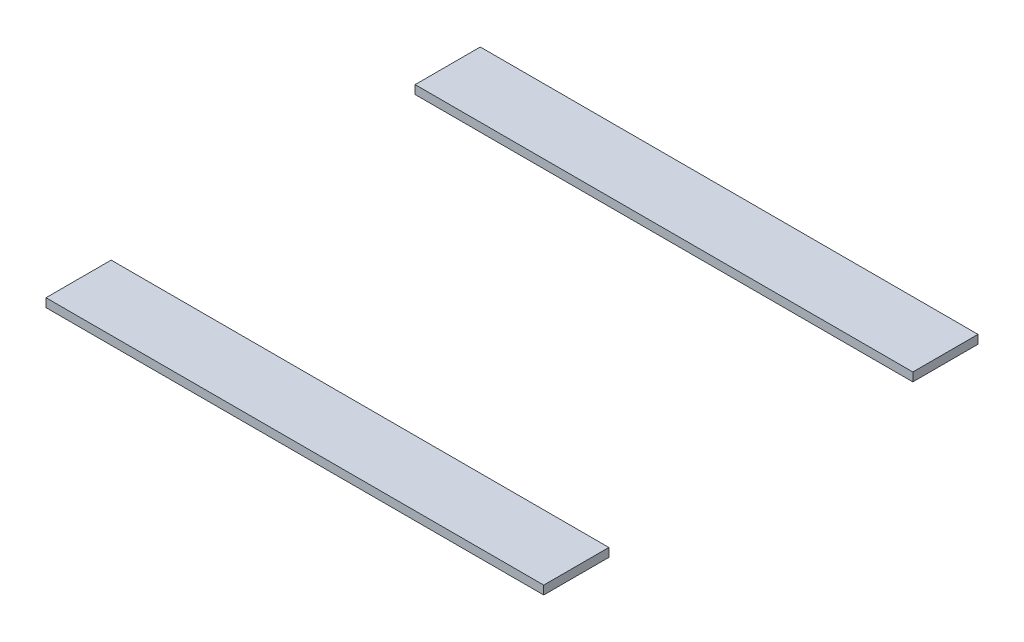
from build123d import *

# Parameters (mm, degrees)
SKETCH1_W             = 184.839561026
SKETCH1_H             = 24.2
BOSS_EXTRUDE1_DEPTH   = 3.2
BOSS_EXTRUDE1_2_DEPTH = 3.2


with BuildPart() as part:
    # Sketch1 → Boss-Extrude1 (new body)
    with BuildSketch(Plane(origin=(0, 0, 0), x_dir=(1, 0, 0), z_dir=(0, 1, 0))):
        with Locations((11.780219487, 68.539561026)):
            Rectangle(SKETCH1_W, SKETCH1_H)
    extrude(amount=-BOSS_EXTRUDE1_DEPTH)


with BuildPart() as body_2:
    # Sketch1 → Boss-Extrude1 2 (new body)
    with BuildSketch(Plane(origin=(0, 0, 0), x_dir=(1, 0, 0), z_dir=(0, 1, 0))):
        with Locations((11.780219487, -68.539561026)):
            Rectangle(SKETCH1_W, SKETCH1_H)
    extrude(amount=-BOSS_EXTRUDE1_2_DEPTH)


solid = Compound([part.part, body_2.part])
